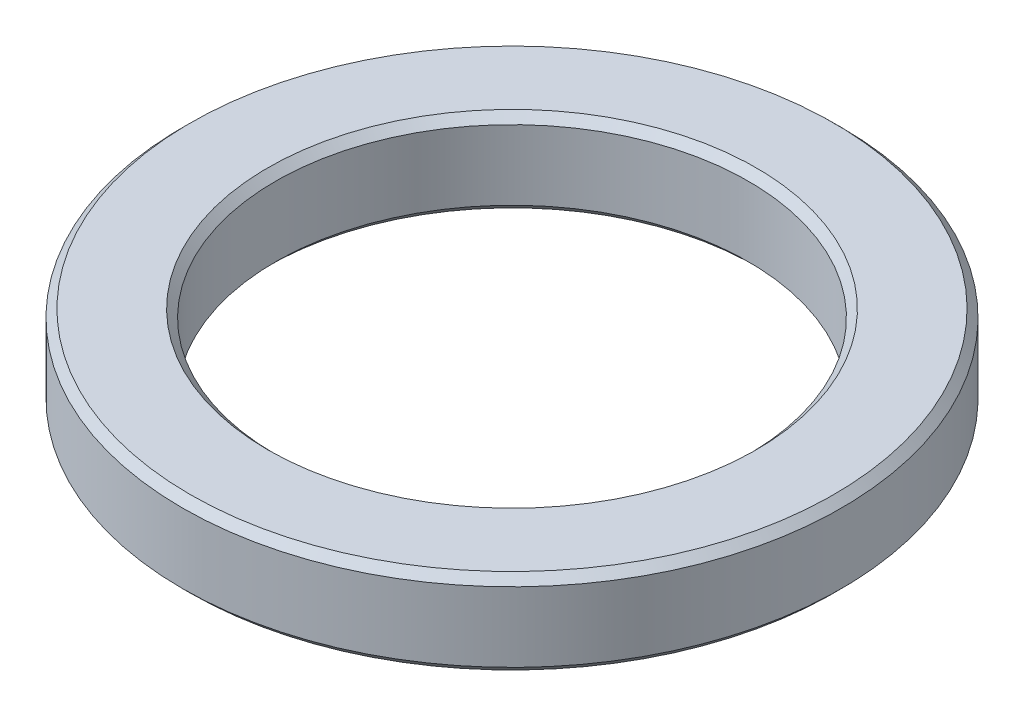
from build123d import *

# Parameters (mm, degrees)
SKETCH1_R           = 4.25
SKETCH1_R_2         = 3.05
BOSS_EXTRUDE1_DEPTH = 1.1
CHAMFER1_SIZE       = 0.1


with BuildPart() as part:
    # Sketch1 → Boss-Extrude1 (new body)
    with BuildSketch(Plane(origin=(0, 0, 0), x_dir=(1, 0, 0), z_dir=(0, 1, 0))):
        with Locations(Location((0, 0, 0), (0, 0, 270))):
            Circle(SKETCH1_R)
        with Locations(Location((0, 0, 0), (0, 0, 270))):
            Circle(SKETCH1_R_2, mode=Mode.SUBTRACT)
    extrude(amount=BOSS_EXTRUDE1_DEPTH)

    # Chamfer1
    chamfer1_edges = [part.edges().sort_by_distance(p)[0] for p in [
        (0, 0, -4.25),
        (0, 1.1, -4.25),
        (0, 0, -3.05),
        (0, 1.1, -3.05),
    ]]
    chamfer(chamfer1_edges, length=CHAMFER1_SIZE)


solid = part.part
